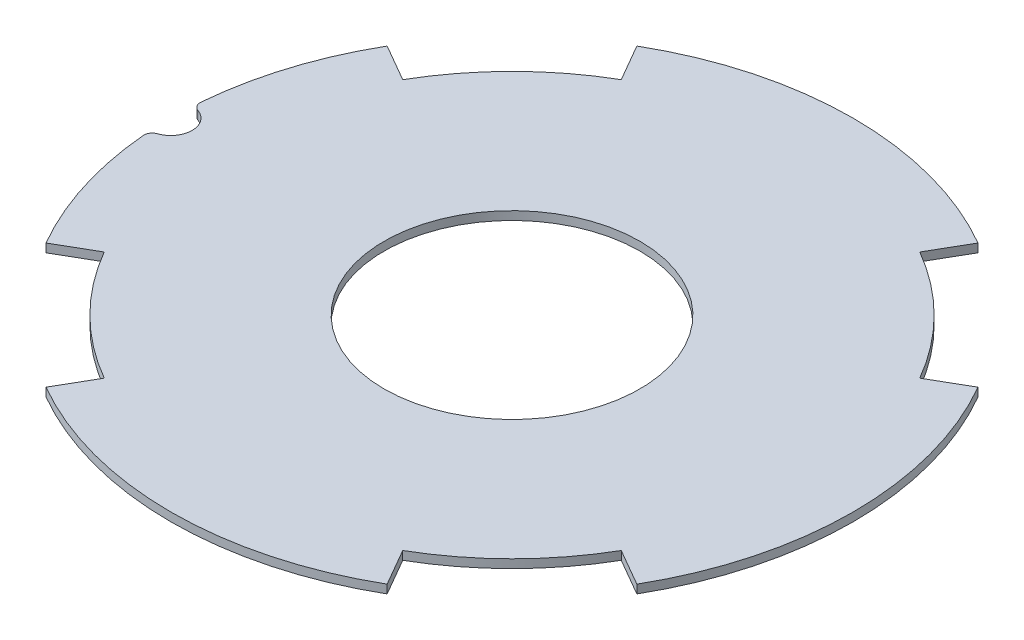
from build123d import *

# Parameters (mm, degrees)
SKETCH1_R           = 15
BOSS_EXTRUDE1_DEPTH = 1


with BuildPart() as part:
    # Sketch1 → Boss-Extrude1 (new body)
    with BuildSketch(Plane(origin=(0, 0, 0), x_dir=(1, 0, 0), z_dir=(0, 1, 0))):
        with BuildLine():
            Line((34.641016151, -20), (30.310889132, -17.5))
            ThreePointArc((30.310889132, -17.5), (24.748737342, -24.748737342), (17.5, -30.310889132))
            Line((17.5, -30.310889132), (20, -34.641016151))
            ThreePointArc((20, -34.641016151), (0, -40), (-20, -34.641016151))
            Line((-20, -34.641016151), (-17.5, -30.310889132))
            ThreePointArc((-17.5, -30.310889132), (-24.748737342, -24.748737342), (-30.310889132, -17.5))
            Line((-30.310889132, -17.5), (-34.641016151, -20))
            ThreePointArc((-34.641016151, -20), (-38.162605992, -11.983968621), (-39.855769231, -3.393767674))
            ThreePointArc((-39.855769231, -3.393767674), (-39.69750686, -2.763455807), (-39.185267857, -2.363516773))
            ThreePointArc((-39.185267857, -2.363516773), (-37.5, 0), (-39.185267857, 2.363516773))
            ThreePointArc((-39.185267857, 2.363516773), (-39.69750686, 2.763455807), (-39.855769231, 3.393767674))
            ThreePointArc((-39.855769231, 3.393767674), (-38.162605992, 11.983968621), (-34.641016151, 20))
            Line((-34.641016151, 20), (-30.310889132, 17.5))
            ThreePointArc((-30.310889132, 17.5), (-24.748737342, 24.748737342), (-17.5, 30.310889132))
            Line((-17.5, 30.310889132), (-20, 34.641016151))
            ThreePointArc((-20, 34.641016151), (0, 40), (20, 34.641016151))
            Line((20, 34.641016151), (17.5, 30.310889132))
            ThreePointArc((17.5, 30.310889132), (24.748737342, 24.748737342), (30.310889132, 17.5))
            Line((30.310889132, 17.5), (34.641016151, 20))
            ThreePointArc((34.641016151, 20), (40, 0), (34.641016151, -20))
        make_face()
        with Locations(Location((0, 0, 0), (0, 0, 270))):
            Circle(SKETCH1_R, mode=Mode.SUBTRACT)
    extrude(amount=BOSS_EXTRUDE1_DEPTH)


solid = part.part
